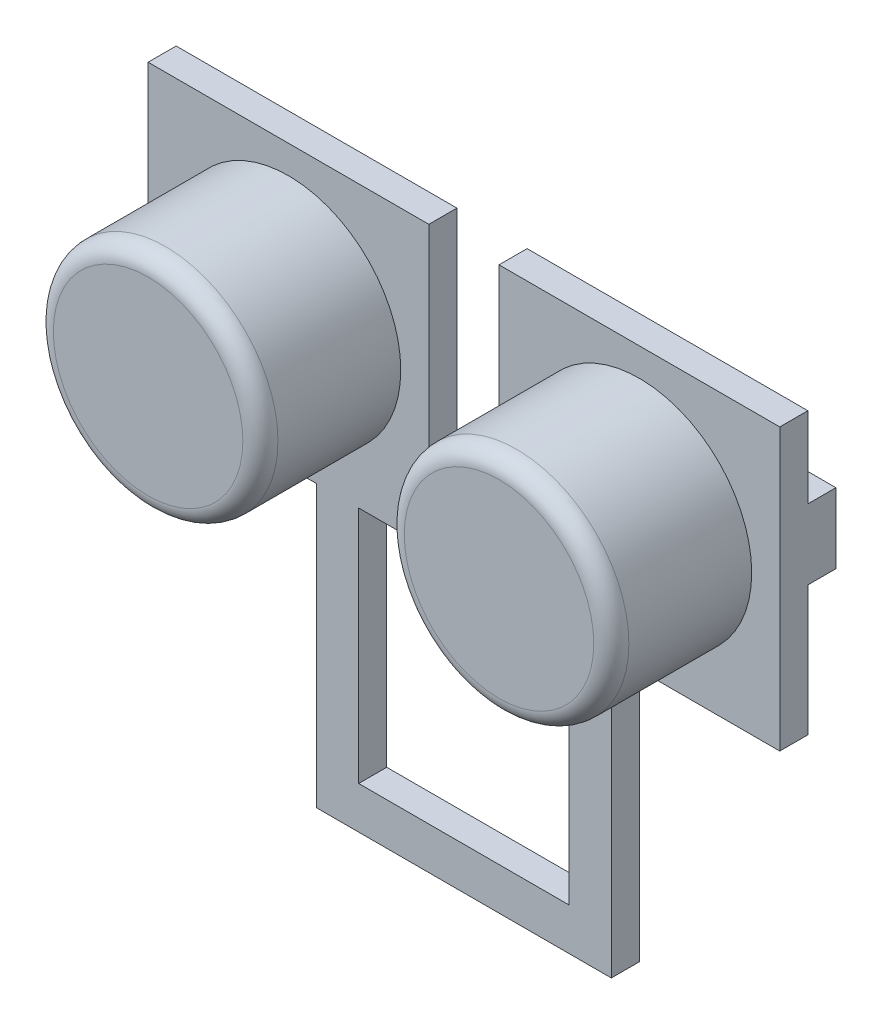
from build123d import *

# Parameters (mm, degrees)
SKETCH_2_R        = 3.2
EXTRUDE_1_DEPTH   = 4
EXTRUDE_1_2_DEPTH = 4
SKETCH_3_W        = 8
SKETCH_3_H        = 8
EXTRUDE_2_DEPTH   = 0.8
SKETCH_4_W        = 2
SKETCH_4_H        = 2
EXTRUDE_3_DEPTH   = 0.8
SKETCH_5_W        = 6
SKETCH_5_H        = 1.2
SKETCH_5_W_2      = 1.2
SKETCH_5_H_2      = 8
EXTRUDE_4_DEPTH   = 0.8
FILLET_1_R        = 0.5


with BuildPart() as part:
    # Эскиз2 → Бобышка-Вытянуть1 (new body)
    with BuildSketch(Plane.XY):
        with Locations((-5, 0)):
            Circle(SKETCH_2_R)
    extrude(amount=EXTRUDE_1_DEPTH)



with BuildPart() as body_2:
    # Эскиз2 → Extrude 1 2 (new body)
    with BuildSketch(Plane.XY):
        with Locations((5, 0)):
            Circle(SKETCH_2_R)
    extrude(amount=EXTRUDE_1_2_DEPTH)


with BuildPart() as part_1:
    add(part.part)

    add(body_2.part)  # Бобышка-Вытянуть2 merges body 2
    # Эскиз3 → Бобышка-Вытянуть2 (add)
    with BuildSketch(Plane(origin=(0, 0, 0), x_dir=(-1, 0, 0), z_dir=(0, 0, -1))):
        with Locations((-5, 0)):
            Rectangle(SKETCH_3_W, SKETCH_3_H)
        with Locations((5, 0)):
            Rectangle(SKETCH_3_W, SKETCH_3_H)
    extrude(amount=EXTRUDE_2_DEPTH)

    # Эскиз4 → Бобышка-Вытянуть3 (add)
    with BuildSketch(Plane(origin=(0, 0, -0.8), x_dir=(-1, 0, 0), z_dir=(0, 0, -1))):
        with Locations((-8, 0.7)):
            Rectangle(SKETCH_4_W, SKETCH_4_H)
        with Locations((8, 0.7)):
            Rectangle(SKETCH_4_W, SKETCH_4_H)
    extrude(amount=EXTRUDE_3_DEPTH)

    # Эскиз5 → Бобышка-Вытянуть4 (add)
    with BuildSketch(Plane(origin=(0, 0, -0.8), x_dir=(-1, 0, 0), z_dir=(0, 0, -1))):
        Polygon((-3, -10.8), (-3, -4), (-4.2, -4), (-4.2, -12), (-3, -12), align=None)
        with Locations((0, -11.4)):
            Rectangle(SKETCH_5_W, SKETCH_5_H)
        with Locations((3.6, -8)):
            Rectangle(SKETCH_5_W_2, SKETCH_5_H_2)
    extrude(amount=-EXTRUDE_4_DEPTH)

    # Скругление1
    fillet_1_edges = [part_1.edges().sort_by_distance(p)[0] for p in [
        (-8.2, 0, 4),
        (1.8, 0, 4),
    ]]
    fillet(fillet_1_edges, radius=FILLET_1_R)


solid = part_1.part
